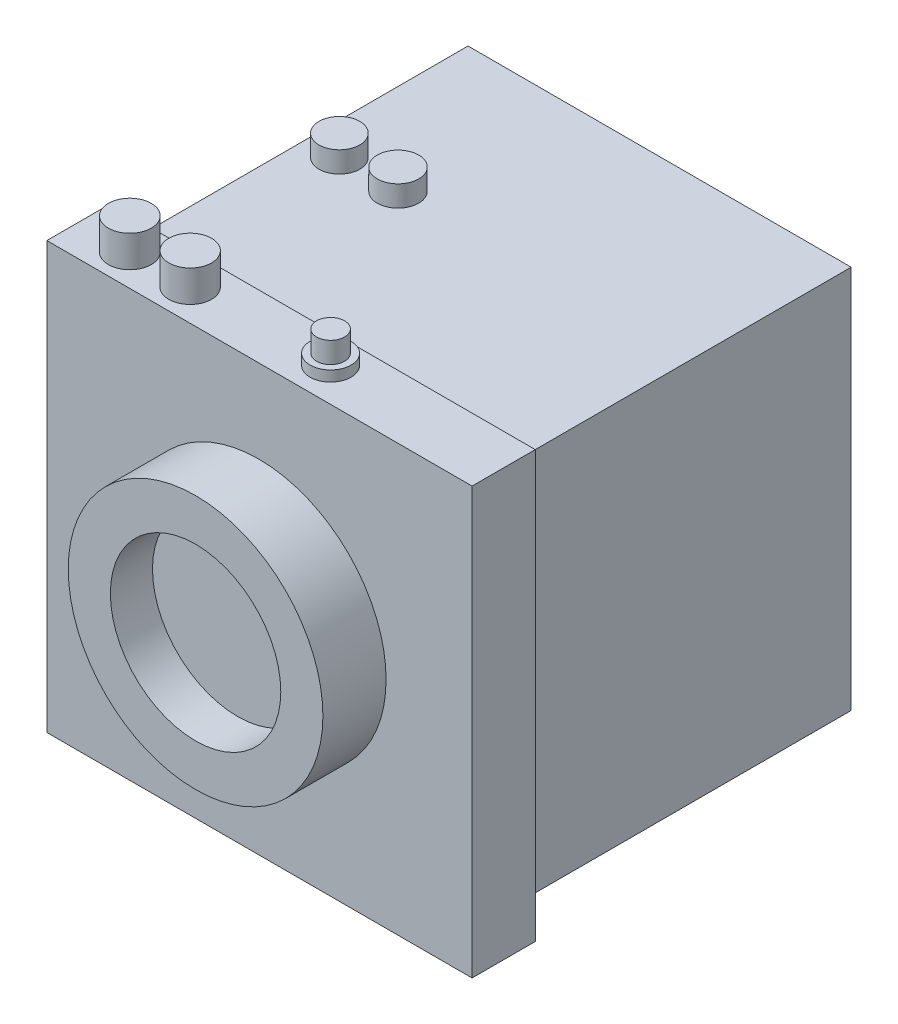
from build123d import *

# Parameters (mm, degrees)
SKETCH1_W           = 51.287597598
SKETCH1_H           = 51.383462266
BOSS_EXTRUDE1_DEPTH = 7.62
SHELL2_T            = -2.54
SKETCH3_W           = 46.207597598
SKETCH3_H           = 46.303462266
BOSS_EXTRUDE2_DEPTH = 45.72
SKETCH8_R           = 15.356608436
BOSS_EXTRUDE4_DEPTH = 7.62
SHELL9_T            = -5.08
SKETCH11_R          = 2.58975373
SKETCH11_R_2        = 2.576633152
BOSS_EXTRUDE5_DEPTH = 3.81
SKETCH12_R          = 2.474939987
BOSS_EXTRUDE6_DEPTH = 1.27
SKETCH13_R          = 1.688973415
BOSS_EXTRUDE7_DEPTH = 2.54
SKETCH16_R          = 2.496690969
SKETCH16_R_2        = 2.462776399
BOSS_EXTRUDE9_DEPTH = 2.54


with BuildPart() as part:
    # Sketch1 → Boss-Extrude1 (new body)
    with BuildSketch(Plane.XY):
        with Locations((-4.505639415, 2.492481379)):
            Rectangle(SKETCH1_W, SKETCH1_H)
    extrude(amount=BOSS_EXTRUDE1_DEPTH)

    # Shell2
    shell2_openings = [part.faces().sort_by_distance(p)[0] for p in [
        (-4.505639415, 2.492481379, 0),
    ]]
    offset(amount=SHELL2_T, openings=shell2_openings, kind=Kind.INTERSECTION)

    # Sketch8 → Boss-Extrude4 (add)
    with BuildSketch(Plane.XY.offset(7.62)):
        with Locations((-4.590970541, 2.784212512)):
            Circle(SKETCH8_R)
    extrude(amount=BOSS_EXTRUDE4_DEPTH)

    # Shell9
    shell9_openings = [part.faces().sort_by_distance(p)[0] for p in [
        (-4.590970541, 2.784212512, 15.24),
    ]]
    offset(amount=SHELL9_T, openings=shell9_openings, kind=Kind.INTERSECTION)

    # Sketch11 → Boss-Extrude5 (add)
    with BuildSketch(Plane(origin=(0, 28.184212512, 0), x_dir=(1, 0, 0), z_dir=(0, 1, 0))):
        with Locations(Location((-23.92482166, -3.835162685, 0), (0, 0, 90))):
            Circle(SKETCH11_R)
        with Locations(Location((-16.646720661, -3.835162685, 0), (0, 0, 90))):
            Circle(SKETCH11_R_2)
    extrude(amount=BOSS_EXTRUDE5_DEPTH)

    # Sketch12 → Boss-Extrude6 (add)
    with BuildSketch(Plane(origin=(0, 28.184212512, 0), x_dir=(1, 0, 0), z_dir=(0, 1, 0))):
        with Locations(Location((0, -3.546492159, 0), (0, 0, 90))):
            Circle(SKETCH12_R)
    extrude(amount=BOSS_EXTRUDE6_DEPTH)

    # Sketch13 → Boss-Extrude7 (add)
    with BuildSketch(Plane(origin=(0, 29.454212512, 0), x_dir=(1, 0, 0), z_dir=(0, 1, 0))):
        with Locations(Location((0, -3.546492159, 0), (0, 0, 270))):
            Circle(SKETCH13_R)
    extrude(amount=BOSS_EXTRUDE7_DEPTH)


with BuildPart() as body_2:
    # Sketch3 → Boss-Extrude2 (new body)
    with BuildSketch(Plane(origin=(0, 0, 5.08), x_dir=(-1, 0, 0), z_dir=(0, 0, -1))):
        with Locations((4.505639415, 2.492481379)):
            Rectangle(SKETCH3_W, SKETCH3_H)
    extrude(amount=BOSS_EXTRUDE2_DEPTH)

    # Sketch16 → Boss-Extrude9 (add)
    with BuildSketch(Plane(origin=(0, 25.644212512, 0), x_dir=(1, 0, 0), z_dir=(0, 1, 0))):
        with Locations(Location((-16.658967026, 21.240915572, 0), (0, 0, 90))):
            Circle(SKETCH16_R)
        with Locations(Location((-23.72655588, 21.240915572, 0), (0, 0, 90))):
            Circle(SKETCH16_R_2)
    extrude(amount=BOSS_EXTRUDE9_DEPTH)


solid = Compound([part.part, body_2.part])
